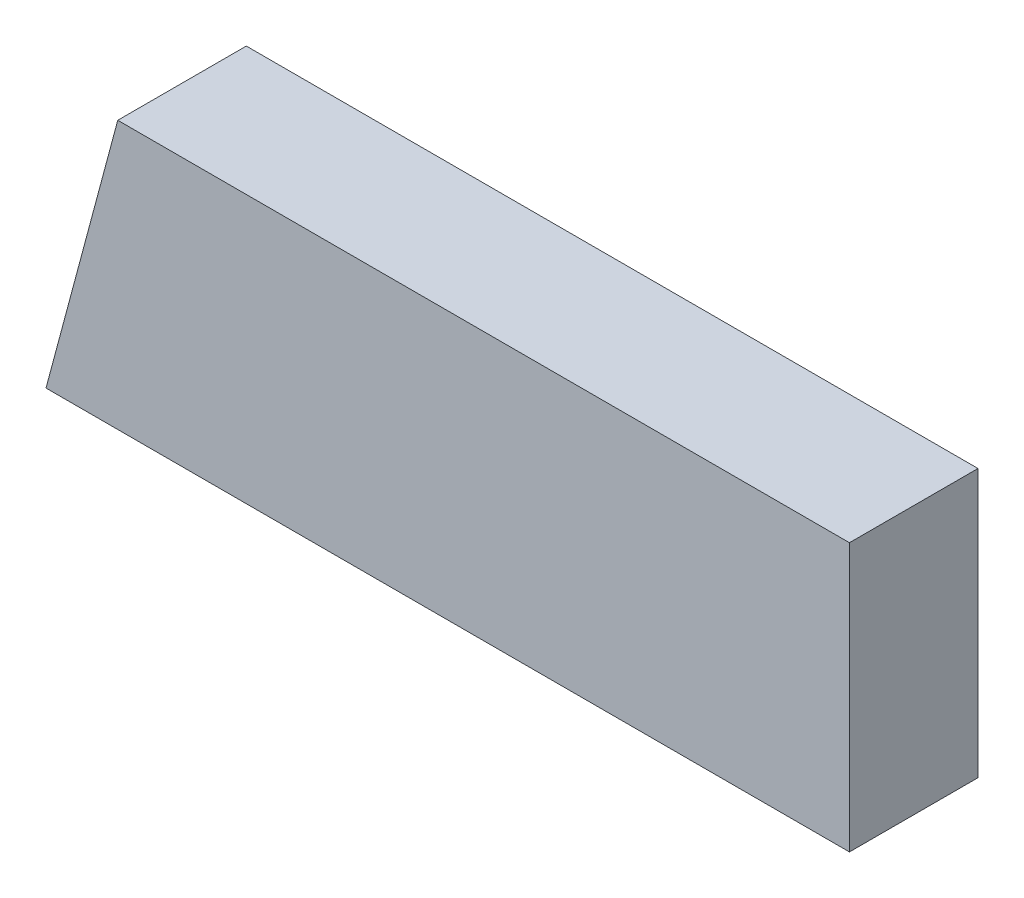
from build123d import *

# Parameters (mm, degrees)
BOSS_EXTRUDE1_DEPTH = 12


with BuildPart() as part:
    # Sketch1 → Boss-Extrude1 (new body)
    with BuildSketch(Plane(origin=(0, 0, 0), x_dir=(0.9659258262890718, -0.2588190451025078, 0), z_dir=(0, 0, 1))):
        Polygon((-36.304051897, 4.27626676), (29.669908947, 21.95393629), (36.140385074, -2.194209368), (-36.304051897, -21.60563775), align=None)
    extrude(amount=-BOSS_EXTRUDE1_DEPTH)


solid = part.part
